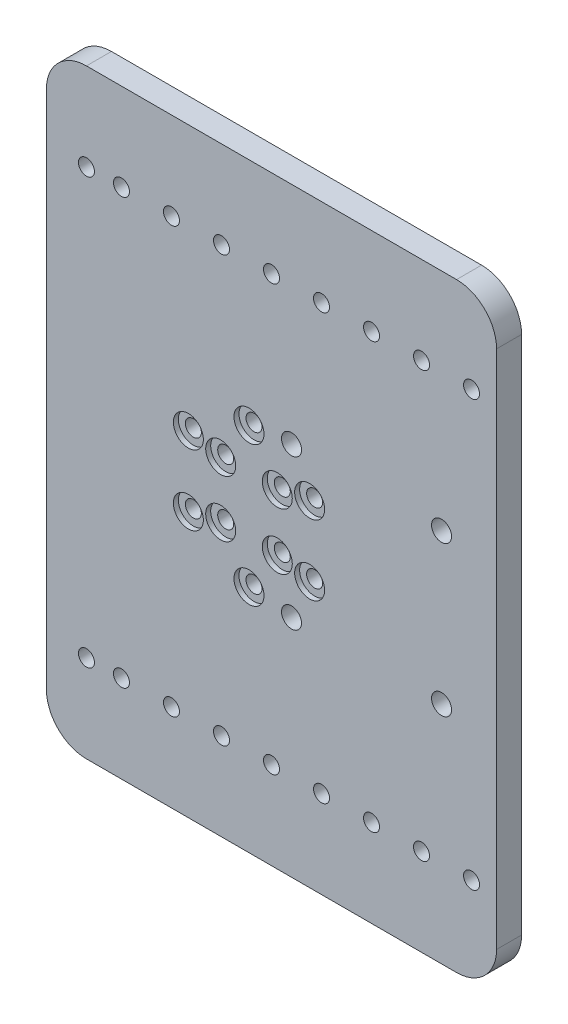
from build123d import *

# Parameters (mm, degrees)
SKETCH_1_W            = 90
SKETCH_1_H            = 120
SKETCH_1_R            = 2
SKETCH_1_R_2          = 1.6
EXTRUDE_1_DEPTH       = 5
FILLET_1_R            = 8
F_3_2_PCD16_R         = 1.6
CUT_EXTRUDE_3_2_DEPTH = 10
XRU1008_6_1_2_R       = 3
XRU1008_6_1_DEPTH     = 1
XRU2012_3_2_28_2_R    = 1.6
XRU2012_3_2_28_DEPTH  = 5
XRU2012_6_1_2_R       = 3
XRU2012_6_1_DEPTH     = 1


with BuildPart() as part:
    # 草图1 → 凸台-拉伸1 (new body)
    with BuildSketch(Plane.XY):
        with Locations((45, -60)):
            Rectangle(SKETCH_1_W, SKETCH_1_H)
        with Locations((79, -45)):
            Circle(SKETCH_1_R, mode=Mode.SUBTRACT)
        with Locations((79, -75)):
            Circle(SKETCH_1_R, mode=Mode.SUBTRACT)
        with Locations((49, -45)):
            Circle(SKETCH_1_R, mode=Mode.SUBTRACT)
        with Locations((49, -75)):
            Circle(SKETCH_1_R, mode=Mode.SUBTRACT)
        with Locations((85, -102.5)):
            Circle(SKETCH_1_R_2, mode=Mode.SUBTRACT)
        with Locations((75, -102.5)):
            Circle(SKETCH_1_R_2, mode=Mode.SUBTRACT)
        with Locations((65, -102.5)):
            Circle(SKETCH_1_R_2, mode=Mode.SUBTRACT)
        with Locations((55, -102.5)):
            Circle(SKETCH_1_R_2, mode=Mode.SUBTRACT)
        with Locations((45, -102.5)):
            Circle(SKETCH_1_R_2, mode=Mode.SUBTRACT)
        with Locations((85, -17.5)):
            Circle(SKETCH_1_R_2, mode=Mode.SUBTRACT)
        with Locations((75, -17.5)):
            Circle(SKETCH_1_R_2, mode=Mode.SUBTRACT)
        with Locations((65, -17.5)):
            Circle(SKETCH_1_R_2, mode=Mode.SUBTRACT)
        with Locations((55, -17.5)):
            Circle(SKETCH_1_R_2, mode=Mode.SUBTRACT)
        with Locations((45, -17.5)):
            Circle(SKETCH_1_R_2, mode=Mode.SUBTRACT)
        with Locations((35, -102.5)):
            Circle(SKETCH_1_R_2, mode=Mode.SUBTRACT)
        with Locations((25, -102.5)):
            Circle(SKETCH_1_R_2, mode=Mode.SUBTRACT)
        with Locations((15, -102.5)):
            Circle(SKETCH_1_R_2, mode=Mode.SUBTRACT)
        with Locations((35, -17.5)):
            Circle(SKETCH_1_R_2, mode=Mode.SUBTRACT)
        with Locations((25, -17.5)):
            Circle(SKETCH_1_R_2, mode=Mode.SUBTRACT)
        with Locations((15, -17.5)):
            Circle(SKETCH_1_R_2, mode=Mode.SUBTRACT)
        with Locations((8, -102.5)):
            Circle(SKETCH_1_R_2, mode=Mode.SUBTRACT)
        with Locations((8, -17.5)):
            Circle(SKETCH_1_R_2, mode=Mode.SUBTRACT)
    extrude(amount=EXTRUDE_1_DEPTH)

    # 圆角1
    fillet_1_edges = [part.edges().sort_by_distance(p)[0] for p in [
        (0, -120, 2.5),
        (90, -120, 2.5),
        (90, 0, 2.5),
        (0, 0, 2.5),
    ]]
    fillet(fillet_1_edges, radius=FILLET_1_R)

    # 内圈四孔_Ø3.2_PCD16 → 内圈四孔_通孔_Ø3.2 (cut)
    with BuildSketch(Plane(origin=(0, 0, 0), x_dir=(-1, 0, 0), z_dir=(0, 0, -1))):
        with Locations((-46.156854249, -54.343145751)):
            Circle(F_3_2_PCD16_R)
        with Locations((-34.843145751, -54.343145751)):
            Circle(F_3_2_PCD16_R)
        with Locations((-34.843145751, -65.656854249)):
            Circle(F_3_2_PCD16_R)
        with Locations((-46.156854249, -65.656854249)):
            Circle(F_3_2_PCD16_R)
    extrude(amount=-CUT_EXTRUDE_3_2_DEPTH, mode=Mode.SUBTRACT)

    # XRU1008__6___1 2 → XRU1008__6___1 (cut)
    with BuildSketch(Plane.XY.offset(5)):
        with Locations((46.156854249, -54.343145751)):
            Circle(XRU1008_6_1_2_R)
        with Locations((34.843145751, -54.343145751)):
            Circle(XRU1008_6_1_2_R)
        with Locations((34.843145751, -65.656854249)):
            Circle(XRU1008_6_1_2_R)
        with Locations((46.156854249, -65.656854249)):
            Circle(XRU1008_6_1_2_R)
    extrude(amount=-XRU1008_6_1_DEPTH, mode=Mode.SUBTRACT)

    # XRU2012__3.2___28 2 → XRU2012__3.2___28 (cut)
    with BuildSketch(Plane.XY.offset(5)):
        with Locations((52.624355653, -53)):
            Circle(XRU2012_3_2_28_2_R)
        with Locations((40.5, -46)):
            Circle(XRU2012_3_2_28_2_R)
        with Locations((28.375644347, -53)):
            Circle(XRU2012_3_2_28_2_R)
        with Locations((28.375644347, -67)):
            Circle(XRU2012_3_2_28_2_R)
        with Locations((40.5, -74)):
            Circle(XRU2012_3_2_28_2_R)
        with Locations((52.624355653, -67)):
            Circle(XRU2012_3_2_28_2_R)
    extrude(amount=-XRU2012_3_2_28_DEPTH, mode=Mode.SUBTRACT)

    # XRU2012__6___1 2 → XRU2012__6___1 (cut)
    with BuildSketch(Plane.XY.offset(5)):
        with Locations((52.624355653, -53)):
            Circle(XRU2012_6_1_2_R)
        with Locations((40.5, -46)):
            Circle(XRU2012_6_1_2_R)
        with Locations((28.375644347, -53)):
            Circle(XRU2012_6_1_2_R)
        with Locations((28.375644347, -67)):
            Circle(XRU2012_6_1_2_R)
        with Locations((40.5, -74)):
            Circle(XRU2012_6_1_2_R)
        with Locations((52.624355653, -67)):
            Circle(XRU2012_6_1_2_R)
    extrude(amount=-XRU2012_6_1_DEPTH, mode=Mode.SUBTRACT)


solid = part.part
